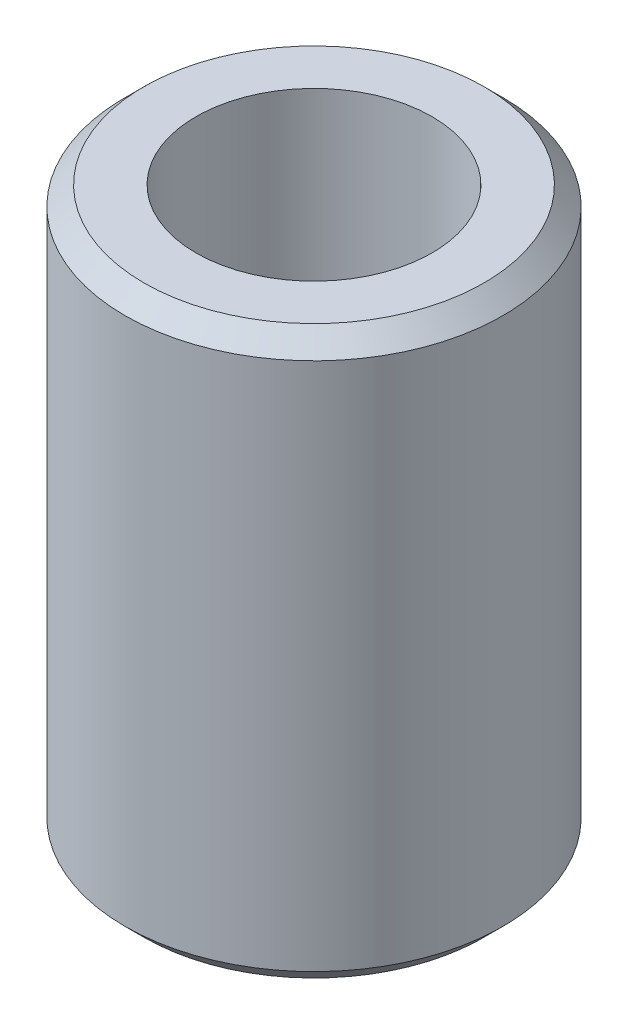
from build123d import *

# Parameters (mm, degrees)
SKETCH1_R           = 20
SKETCH1_R_2         = 12.5
BOSS_EXTRUDE1_DEPTH = 30
CHAMFER1_SIZE       = 2


with BuildPart() as part:
    # Sketch1 → Boss-Extrude1 (new, symmetric)
    with BuildSketch(Plane(origin=(0, 0, 0), x_dir=(1, 0, 0), z_dir=(0, 1, 0))):
        with Locations(Location((0, 0, 0), (0, 0, 270))):
            Circle(SKETCH1_R)
        with Locations(Location((0, 0, 0), (0, 0, 270))):
            Circle(SKETCH1_R_2, mode=Mode.SUBTRACT)
    extrude(amount=BOSS_EXTRUDE1_DEPTH, both=True)

    # Chamfer1
    chamfer1_edges = [part.edges().sort_by_distance(p)[0] for p in [
        (0, -30, -20),
        (0, 30, -20),
    ]]
    chamfer(chamfer1_edges, length=CHAMFER1_SIZE)


solid = part.part
